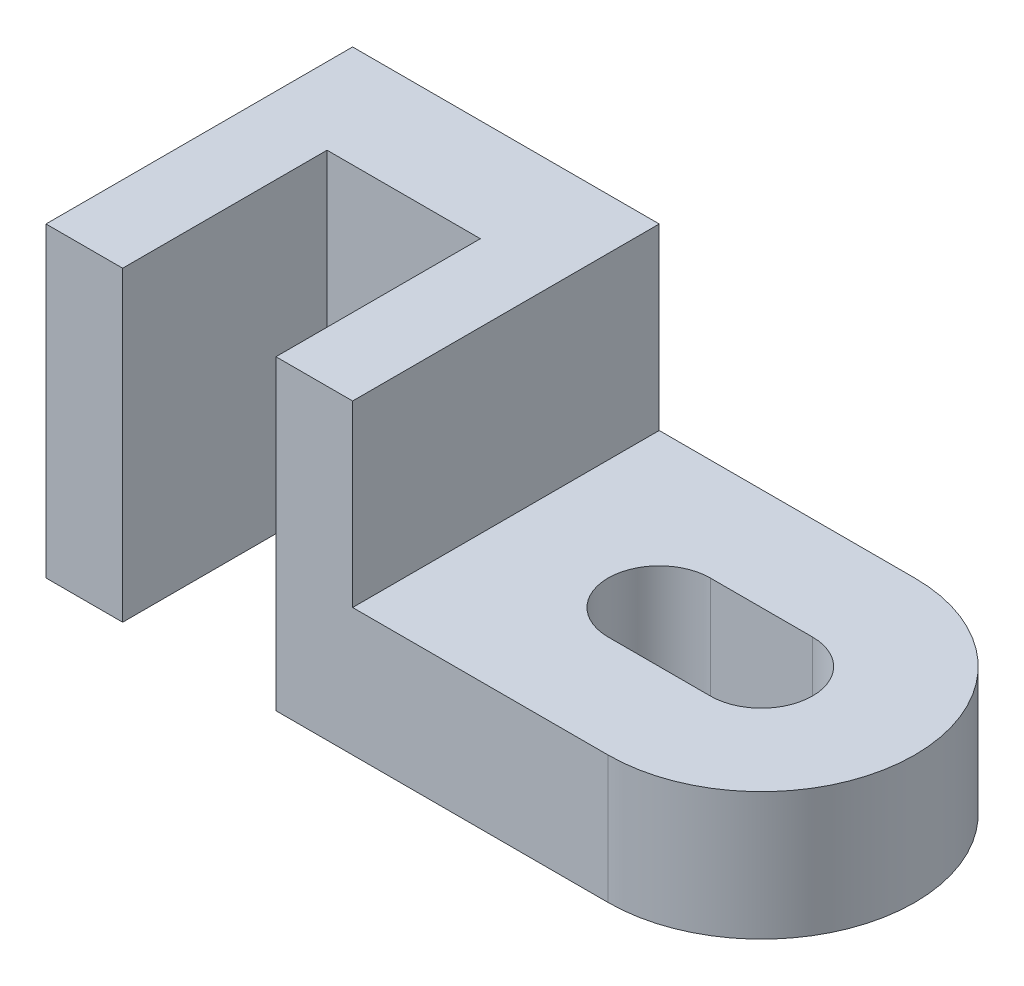
from build123d import *

# Parameters (mm, degrees)
BOSS_EXTRUDE1_DEPTH = 24
BOSS_EXTRUDE2_DEPTH = 10


with BuildPart() as part:
    # Sketch1 → Boss-Extrude1 (new body)
    with BuildSketch(Plane(origin=(0, 0, 0), x_dir=(1, 0, 0), z_dir=(0, 1, 0))):
        Polygon((0, -12), (0, 12), (-24, 12), (-24, -12), (-18, -12), (-18, 4), (-6, 4), (-6, -12), align=None)
    extrude(amount=BOSS_EXTRUDE1_DEPTH)

    # Sketch1<3> → Boss-Extrude2 (add)
    with BuildSketch(Plane(origin=(0, 0, 0), x_dir=(1, 0, 0), z_dir=(0, 1, 0))):
        with BuildLine():
            Line((20, 12), (0, 12))
            Line((0, 12), (0, -12))
            Line((0, -12), (20, -12))
            ThreePointArc((20, -12), (32, 0), (20, 12))
        make_face()
        with BuildLine():
            ThreePointArc((20, 4), (24, 0), (20, -4))
            Line((20, -4), (12, -4))
            ThreePointArc((12, -4), (8, 0), (12, 4))
            Line((12, 4), (20, 4))
        make_face(mode=Mode.SUBTRACT)
    extrude(amount=BOSS_EXTRUDE2_DEPTH)


solid = part.part
